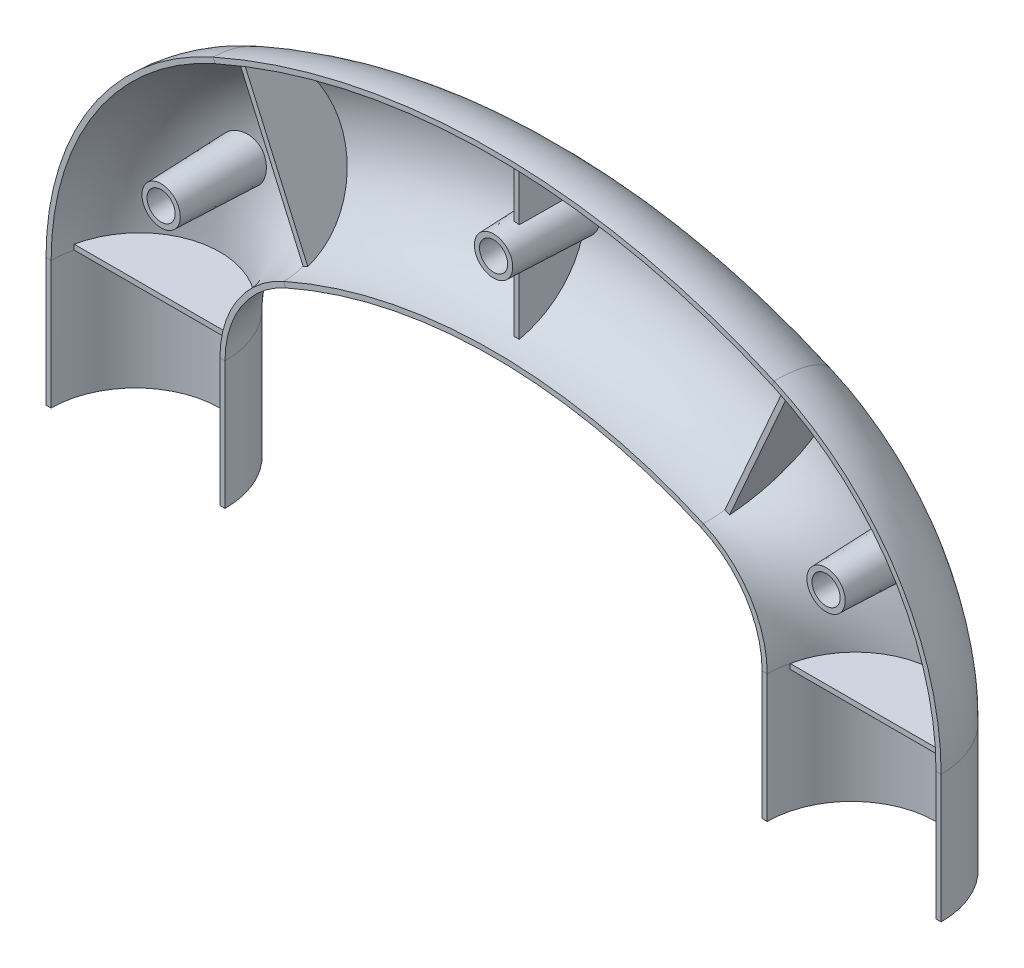
from build123d import *

# Parameters (mm, degrees)
EXTRUDE_THIN2_REACH = 317.103
SKETCH5_W           = 83.82
SKETCH5_H           = 2.54
EXTRUDE_THIN2_DRAFT = 2
SKETCH5_W_2         = 2.54
SKETCH5_H_2         = 31.496
SKETCH5_H_3         = 33.274
BOSS_EXTRUDE1_REACH = 318.37
SKETCH3_R           = 9.525
SKETCH3_R_2         = 6.985
BOSS_EXTRUDE1_DRAFT = 2


with BuildPart() as part:
    # Sweep1: sweep along a path in Sketch2
    with BuildLine(Plane.XY) as sweep1_path:
        Line((-133.35, 0), (-133.35, 63.5))
        ThreePointArc((-133.35, 63.5), (-125.147094971, 91.179008291), (-103.1875, 109.919108067))
        ThreePointArc((-103.1875, 109.919108067), (0, 131.823567731), (103.1875, 109.919108067))
        ThreePointArc((103.1875, 109.919108067), (125.147094971, 91.179008291), (133.35, 63.5))
        Line((133.35, 63.5), (133.35, 0))
    # Sketch1 → Sweep1 (sweep)
    with BuildSketch(Plane(origin=(0, 0, 0), x_dir=(1, 0, 0), z_dir=(0, 1, 0))):
        with BuildLine():
            Line((-222.25, 0), (-219.71, 0))
            ThreePointArc((-219.71, 0), (-177.8, 41.91), (-135.89, 0))
            Line((-135.89, 0), (-133.35, 0))
            ThreePointArc((-133.35, 0), (-177.8, 44.45), (-222.25, 0))
        make_face()
    sweep(path=sweep1_path.line)




with BuildPart() as extrude_thin2_long_prism_1:
    # Sketch5 → Extrude-Thin2 (the long prism of profile 1, to be tilted and cut off)
    with BuildSketch(Plane.XY.offset(-10.16)):
        with Locations((-177.8, 64.77)):
            Rectangle(SKETCH5_W, SKETCH5_H)
    extrude(amount=-EXTRUDE_THIN2_REACH)
    extrude_thin2_tool1_sides = [extrude_thin2_long_prism_1.faces().sort_by_distance(p)[0] for p in [
        (-177.8, 63.5, -168.7115),
        (-219.71, 64.77, -168.7115),
        (-177.8, 66.04, -168.7115),
        (-135.89, 64.77, -168.7115),
    ]]
    draft(extrude_thin2_tool1_sides, Plane.XY.offset(-10.16), EXTRUDE_THIN2_DRAFT)  # the draft: side faces tilted about the start plane


with BuildPart() as part_1:
    add(part.part)
    extrude_thin2_tool1 = extrude_thin2_long_prism_1.part - part.part



with BuildPart() as extrude_thin2_long_prism_2:
    # Sketch5 → Extrude-Thin2 (the long prism of profile 2, to be tilted and cut off)
    with BuildSketch(Plane.XY.offset(-10.16)):
        Polygon((-104.211399501, 112.243592916), (-138.000083051, 188.951592916), (-135.675598202, 189.975492417), (-101.886914653, 113.267492417), align=None)
    extrude(amount=-EXTRUDE_THIN2_REACH)
    extrude_thin2_tool2_sides = [extrude_thin2_long_prism_2.faces().sort_by_distance(p)[0] for p in [
        (-121.105741276, 150.597592916, -168.7115),
        (-136.837840627, 189.463542666, -168.7115),
        (-118.781256428, 151.621492417, -168.7115),
        (-103.049157077, 112.755542666, -168.7115),
    ]]
    draft(extrude_thin2_tool2_sides, Plane.XY.offset(-10.16), EXTRUDE_THIN2_DRAFT)  # the draft: side faces tilted about the start plane


with BuildPart() as part_2:
    add(part_1.part)
    extrude_thin2_tool2 = extrude_thin2_long_prism_2.part - part.part



with BuildPart() as extrude_thin2_long_prism_3:
    # Sketch5 → Extrude-Thin2 (the long prism of profile 3, to be tilted and cut off)
    with BuildSketch(Plane.XY.offset(-10.16)):
        Polygon((104.211399501, 112.243592916), (138.000083051, 188.951592916), (140.324567899, 187.927693414), (106.53588435, 111.219693414), align=None)
    extrude(amount=-EXTRUDE_THIN2_REACH)
    extrude_thin2_tool3_sides = [extrude_thin2_long_prism_3.faces().sort_by_distance(p)[0] for p in [
        (121.105741276, 150.597592916, -168.7115),
        (139.162325475, 188.439643165, -168.7115),
        (123.430226125, 149.573693414, -168.7115),
        (105.373641926, 111.731643165, -168.7115),
    ]]
    draft(extrude_thin2_tool3_sides, Plane.XY.offset(-10.16), EXTRUDE_THIN2_DRAFT)  # the draft: side faces tilted about the start plane


with BuildPart() as part_3:
    add(part_2.part)
    extrude_thin2_tool3 = extrude_thin2_long_prism_3.part - part.part



with BuildPart() as extrude_thin2_long_prism_4:
    # Sketch5 → Extrude-Thin2 (the long prism of profile 4, to be tilted and cut off)
    with BuildSketch(Plane.XY.offset(-10.16)):
        with Locations((177.8, 62.23)):
            Rectangle(SKETCH5_W, SKETCH5_H)
    extrude(amount=-EXTRUDE_THIN2_REACH)
    extrude_thin2_tool4_sides = [extrude_thin2_long_prism_4.faces().sort_by_distance(p)[0] for p in [
        (177.8, 63.5, -168.7115),
        (219.71, 62.23, -168.7115),
        (177.8, 60.96, -168.7115),
        (135.89, 62.23, -168.7115),
    ]]
    draft(extrude_thin2_tool4_sides, Plane.XY.offset(-10.16), EXTRUDE_THIN2_DRAFT)  # the draft: side faces tilted about the start plane


with BuildPart() as part_4:
    add(part_3.part)
    extrude_thin2_tool4 = extrude_thin2_long_prism_4.part - part.part



with BuildPart() as extrude_thin2_long_prism_5:
    # Sketch5 → Extrude-Thin2 (the long prism of profile 5, to be tilted and cut off)
    with BuildSketch(Plane.XY.offset(-10.16)):
        with Locations((1.27, 150.114)):
            Rectangle(SKETCH5_W_2, SKETCH5_H_2)
    extrude(amount=-EXTRUDE_THIN2_REACH)
    extrude_thin2_tool5_sides = [extrude_thin2_long_prism_5.faces().sort_by_distance(p)[0] for p in [
        (0, 150.114, -168.7115),
        (1.27, 165.862, -168.7115),
        (2.54, 150.114, -168.7115),
        (1.27, 134.366, -168.7115),
    ]]
    draft(extrude_thin2_tool5_sides, Plane.XY.offset(-10.16), EXTRUDE_THIN2_DRAFT)  # the draft: side faces tilted about the start plane


with BuildPart() as part_5:
    add(part_4.part)
    extrude_thin2_tool5 = extrude_thin2_long_prism_5.part - part.part



with BuildPart() as extrude_thin2_long_prism_6:
    # Sketch5 → Extrude-Thin2 (the long prism of profile 6, to be tilted and cut off)
    with BuildSketch(Plane.XY.offset(-10.16)):
        with Locations((1.27, 201.549)):
            Rectangle(SKETCH5_W_2, SKETCH5_H_3)
    extrude(amount=-EXTRUDE_THIN2_REACH)
    extrude_thin2_tool6_sides = [extrude_thin2_long_prism_6.faces().sort_by_distance(p)[0] for p in [
        (0, 201.549, -168.7115),
        (1.27, 218.186, -168.7115),
        (2.54, 201.549, -168.7115),
        (1.27, 184.912, -168.7115),
    ]]
    draft(extrude_thin2_tool6_sides, Plane.XY.offset(-10.16), EXTRUDE_THIN2_DRAFT)  # the draft: side faces tilted about the start plane


with BuildPart() as part_6:
    add(part_5.part)
    extrude_thin2_tool6 = extrude_thin2_long_prism_6.part - part.part
    add(extrude_thin2_tool1.solids().sort_by_distance((-177.8, 64.77, -10.16))[0])
    add(extrude_thin2_tool2.solids().sort_by_distance((-119.943499, 151.109543, -10.16))[0])
    add(extrude_thin2_tool3.solids().sort_by_distance((122.267984, 150.085643, -10.16))[0])
    add(extrude_thin2_tool4.solids().sort_by_distance((177.8, 62.23, -10.16))[0])
    add(extrude_thin2_tool5.solids().sort_by_distance((1.27, 150.114, -10.16))[0])
    add(extrude_thin2_tool6.solids().sort_by_distance((1.27, 201.549, -10.16))[0])




with BuildPart() as boss_extrude1_long_prism_1:
    # Sketch3 → Boss-Extrude1 (the long prism of profile 1, to be tilted and cut off)
    with BuildSketch(Plane.XY):
        with Locations((-165.1, 114.3)):
            Circle(SKETCH3_R)
        with Locations((-165.1, 114.3)):
            Circle(SKETCH3_R_2, mode=Mode.SUBTRACT)
    extrude(amount=-BOSS_EXTRUDE1_REACH)
    boss_extrude1_tool1_sides = [boss_extrude1_long_prism_1.faces().sort_by_distance(p)[0] for p in [
        (-174.625, 114.3, -159.185),
        (-172.085, 114.3, -159.185),
    ]]
    draft(boss_extrude1_tool1_sides, Plane.XY, BOSS_EXTRUDE1_DRAFT)  # the draft: side faces tilted about the start plane


with BuildPart() as part_7:
    add(part_6.part)
    boss_extrude1_tool1 = boss_extrude1_long_prism_1.part - part_6.part



with BuildPart() as boss_extrude1_long_prism_2:
    # Sketch3 → Boss-Extrude1 (the long prism of profile 2, to be tilted and cut off)
    with BuildSketch(Plane.XY):
        with Locations((0, 175.26)):
            Circle(SKETCH3_R)
        with Locations((0, 175.26)):
            Circle(SKETCH3_R_2, mode=Mode.SUBTRACT)
    extrude(amount=-BOSS_EXTRUDE1_REACH)
    boss_extrude1_tool2_sides = [boss_extrude1_long_prism_2.faces().sort_by_distance(p)[0] for p in [
        (-9.525, 175.26, -159.185),
        (-6.985, 175.26, -159.185),
    ]]
    draft(boss_extrude1_tool2_sides, Plane.XY, BOSS_EXTRUDE1_DRAFT)  # the draft: side faces tilted about the start plane


with BuildPart() as part_8:
    add(part_7.part)
    boss_extrude1_tool2 = boss_extrude1_long_prism_2.part - part_6.part



with BuildPart() as boss_extrude1_long_prism_3:
    # Sketch3 → Boss-Extrude1 (the long prism of profile 3, to be tilted and cut off)
    with BuildSketch(Plane.XY):
        with Locations((165.1, 114.3)):
            Circle(SKETCH3_R)
        with Locations((165.1, 114.3)):
            Circle(SKETCH3_R_2, mode=Mode.SUBTRACT)
    extrude(amount=-BOSS_EXTRUDE1_REACH)
    boss_extrude1_tool3_sides = [boss_extrude1_long_prism_3.faces().sort_by_distance(p)[0] for p in [
        (155.575, 114.3, -159.185),
        (158.115, 114.3, -159.185),
    ]]
    draft(boss_extrude1_tool3_sides, Plane.XY, BOSS_EXTRUDE1_DRAFT)  # the draft: side faces tilted about the start plane


with BuildPart() as part_9:
    add(part_8.part)
    boss_extrude1_tool3 = boss_extrude1_long_prism_3.part - part_6.part
    add(boss_extrude1_tool1.solids().sort_by_distance((-174.355592, 114.3, 0))[0])
    add(boss_extrude1_tool2.solids().sort_by_distance((-9.255592, 175.26, 0))[0])
    add(boss_extrude1_tool3.solids().sort_by_distance((155.844408, 114.3, 0))[0])


solid = part_9.part
